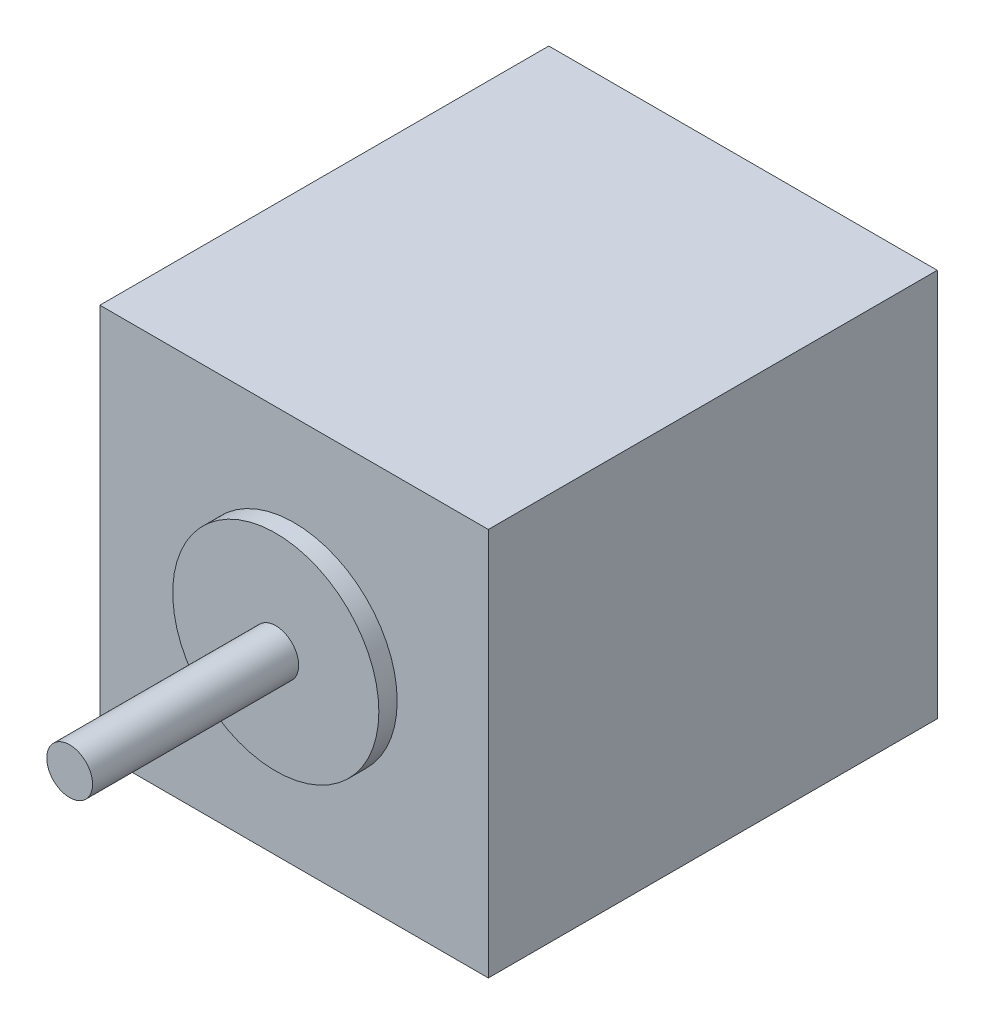
from build123d import *

# Parameters (mm, degrees)
SKETCH1_W           = 42.4
SKETCH1_H           = 42.4
BOSS_EXTRUDE1_DEPTH = 49
SKETCH2_R           = 11.25
BOSS_EXTRUDE2_DEPTH = 2
SKETCH3_R           = 2.5
BOSS_EXTRUDE3_DEPTH = 22.5


with BuildPart() as part:
    # Sketch1 → Boss-Extrude1 (new body)
    with BuildSketch(Plane.XY):
        with Locations((-4.195833333, 4.30625)):
            Rectangle(SKETCH1_W, SKETCH1_H)
    extrude(amount=BOSS_EXTRUDE1_DEPTH)

    # Sketch2 → Boss-Extrude2 (add)
    with BuildSketch(Plane.XY.offset(49)):
        with Locations((-4.195833333, 4.30625)):
            Circle(SKETCH2_R)
    extrude(amount=BOSS_EXTRUDE2_DEPTH)

    # Sketch3 → Boss-Extrude3 (add)
    with BuildSketch(Plane.XY.offset(51)):
        with Locations(Location((-4.195833333, 4.30625, 0), (0, 0, 180))):
            Circle(SKETCH3_R)
    extrude(amount=BOSS_EXTRUDE3_DEPTH)


solid = part.part
